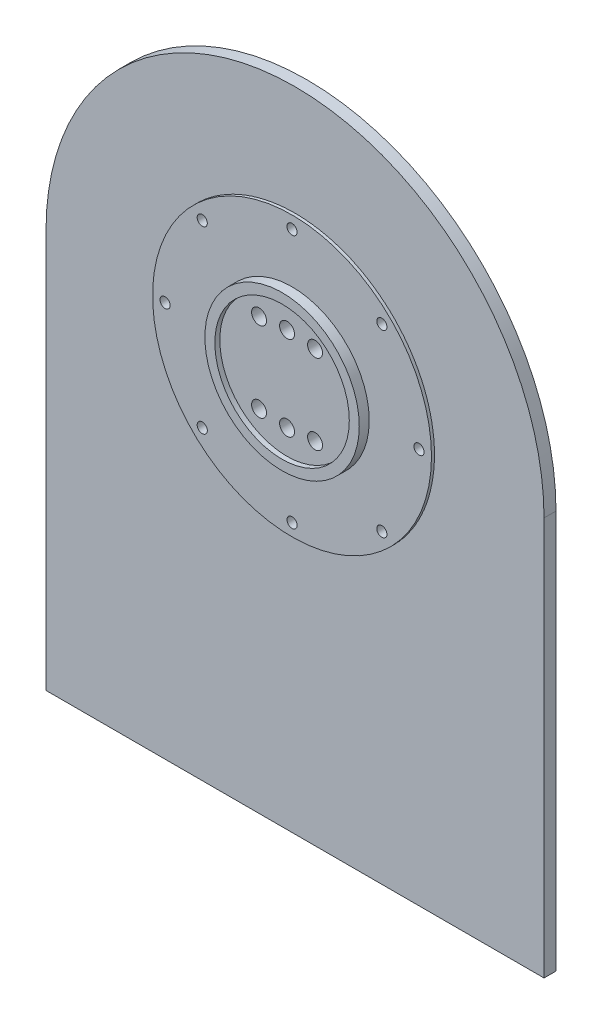
from build123d import *

# Parameters (mm, degrees)
SKETCH_1_R               = 140
EXTRUDE_1_DEPTH          = 25
SKETCH_2_R               = 67.5
CUT_EXTRUDE_1_DEPTH      = 5
SKETCH_5_OUTSIDE_W       = 361.354
SKETCH_5_OUTSIDE_H       = 361.354
SKETCH_5_OUTSIDE_R       = 77.5
CUT_EXTRUDE_4_DEPTH      = 10
SKETCH_6_R               = 7.5
CUT_EXTRUDE_5_DEPTH      = 200.562020435
PATTERN_CIRCULAR_1_COUNT = 8
SKETCH_10_R              = 140
EXTRUDE_2_DEPTH          = 12


with BuildPart() as part:
    # 草图1 → 凸台-拉伸1 (new body)
    with BuildSketch(Plane.XY):
        Circle(SKETCH_1_R)
    extrude(amount=EXTRUDE_1_DEPTH)

    # 草图2 → 切除-拉伸1 (cut)
    with BuildSketch(Plane.XY.offset(25)):
        Circle(SKETCH_2_R)
    extrude(amount=-CUT_EXTRUDE_1_DEPTH, mode=Mode.SUBTRACT)

    # 草图5 outside → 切除-拉伸4 (cut)
    with BuildSketch(Plane.XY.offset(25)):
        Rectangle(SKETCH_5_OUTSIDE_W, SKETCH_5_OUTSIDE_H)
        Circle(SKETCH_5_OUTSIDE_R, mode=Mode.SUBTRACT)
    extrude(amount=-CUT_EXTRUDE_4_DEPTH, mode=Mode.SUBTRACT)

    # 草图6 → 切除-拉伸5 (cut, through all)
    with BuildSketch(Plane(origin=(0, 0, 0), x_dir=(-1, 0, 0), z_dir=(0, 0, -1))):
        with Locations((0, 42.5)):
            Circle(SKETCH_6_R)
        with Locations((0, -42.5)):
            Circle(SKETCH_6_R)
        with Locations((-28.105245381, -40.13845017)):
            Circle(SKETCH_6_R)
        with Locations((28.105245381, -40.13845017)):
            Circle(SKETCH_6_R)
        with Locations(Location((28.105245381, 40.13845017, 0), (0, 0, 180))):
            Circle(SKETCH_6_R)
        with Locations(Location((-28.105245381, 40.13845017, 0), (0, 0, 180))):
            Circle(SKETCH_6_R)
    extrude(amount=-CUT_EXTRUDE_5_DEPTH, mode=Mode.SUBTRACT)

    # 草图8 → M12 螺纹孔1 (revolve, cut)
    with BuildSketch(Plane(origin=(0, 127.5, 15), x_dir=(0, -1, 0), z_dir=(1, 0, 0))):
        Polygon((0, 0), (0, 32.314389157), (5.1, 29.25), (5.1, 0), align=None)
    hole_wizard_m12_1 = revolve(axis=Axis((0, 127.5, 21.35), (0, 0, -1)), mode=Mode.SUBTRACT)

    # 阵列(圆周)1: M12 螺纹孔1 ×8 about axis
    pattern_circular_1_axis = Axis((0, 0, 0), (0, 0, 1))
    for i in range(1, PATTERN_CIRCULAR_1_COUNT):
        add(hole_wizard_m12_1.rotate(pattern_circular_1_axis, i * 360 / PATTERN_CIRCULAR_1_COUNT), mode=Mode.SUBTRACT)


with BuildPart() as body_2:
    # 草图10 → 凸台-拉伸2 (new body)
    with BuildSketch(Plane(origin=(0, 0, 0), x_dir=(-1, 0, 0), z_dir=(0, 0, -1))):
        with BuildLine():
            Line((-250, 0), (-250, -400))
            Line((-250, -400), (250, -400))
            Line((250, -400), (250, 0))
            ThreePointArc((250, 0), (0, 250), (-250, 0))
        make_face()
        Circle(SKETCH_10_R, mode=Mode.SUBTRACT)
    extrude(amount=-EXTRUDE_2_DEPTH)


solid = Compound([part.part, body_2.part])
